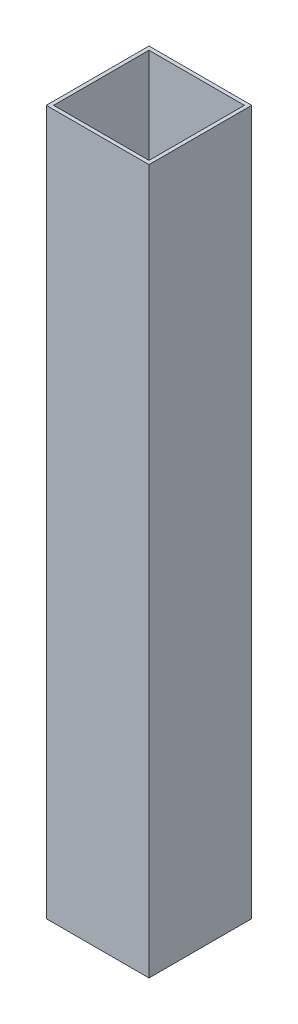
from build123d import *

# Parameters (mm, degrees)
SKETCH1_W           = 44.45
SKETCH1_H           = 44.45
SKETCH1_W_2         = 41.275
SKETCH1_H_2         = 41.275
BOSS_EXTRUDE1_DEPTH = 304.8


with BuildPart() as part:
    # Sketch1 → Boss-Extrude1 (new body)
    with BuildSketch(Plane(origin=(0, 0, 0), x_dir=(1, 0, 0), z_dir=(0, 1, 0))):
        Rectangle(SKETCH1_W, SKETCH1_H)
        Rectangle(SKETCH1_W_2, SKETCH1_H_2, mode=Mode.SUBTRACT)
    extrude(amount=BOSS_EXTRUDE1_DEPTH)


solid = part.part
